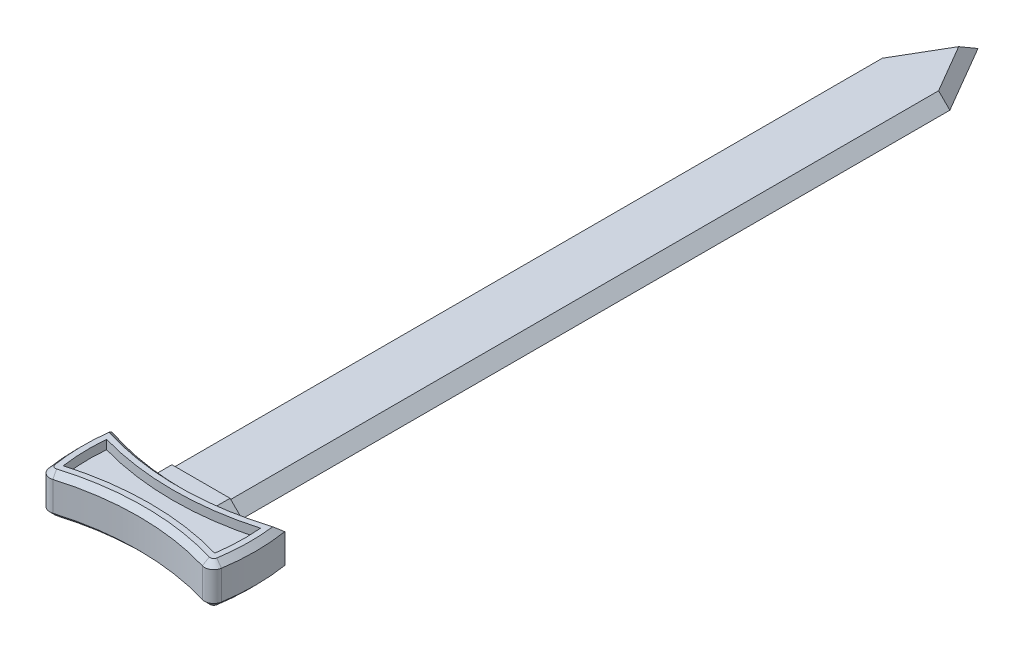
from build123d import *

# Parameters (mm, degrees)
EXTRUDE_1_DEPTH      = 18
CHAMFER_1_SIZE       = 5
CHAMFER_2_SIZE       = 5
CUT_EXTRUDE_1_DEPTH  = 8
EXTRUDE_2_REACH      = 696.741
EXTRUDE_2_END_RADIUS = 240


with BuildPart() as part:
    # 草图4 → 放样1 section 0
    with BuildSketch(Plane(origin=(0, 10, 0), x_dir=(1, 0, 0), z_dir=(0, 1, 0))):
        with BuildLine():
            Line((25, 0), (-25, 0))
            Line((-25, 0), (-25, 630))
            Line((-25, 630), (0, 672.857142857))
            Line((0, 672.857142857), (25, 630))
            Line((25, 630), (25, 0))
        make_face()
    # 草图1 → 放样1 section 1
    with BuildSketch(Plane(origin=(0, 0, 0), x_dir=(1, 0, 0), z_dir=(0, 1, 0))):
        with BuildLine():
            Line((-35, 0), (35, 0))
            Line((35, 0), (35, 630))
            Line((35, 630), (0, 690))
            Line((0, 690), (-35, 630))
            Line((-35, 630), (-35, 0))
        make_face()
    loft_1 = loft()

    # 镜向1: 放样1 across plane
    add(loft_1.mirror(Plane.ZX))



with BuildPart() as body_2:
    # 草图5 → 凸台-拉伸1 (new, symmetric)
    with BuildSketch(Plane(origin=(0, 0, 0), x_dir=(1, 0, 0), z_dir=(0, 1, 0))):
        with BuildLine():
            ThreePointArc((-66.346774613, -65.189169183), (0, -55.5), (66.346774613, -65.189169183))
            ThreePointArc((66.346774613, -65.189169183), (73.061224406, -64.270510235), (76.791165228, -58.612302768))
            ThreePointArc((76.791165228, -58.612302768), (79, -30.5), (76.791165228, -2.387697232))
            ThreePointArc((76.791165228, -2.387697232), (0, -15.004503167), (-76.791165228, -2.387697232))
            ThreePointArc((-76.791165228, -2.387697232), (-79, -30.5), (-76.791165228, -58.612302768))
            ThreePointArc((-76.791165228, -58.612302768), (-73.061224406, -64.270510235), (-66.346774613, -65.189169183))
        make_face()
    extrude(amount=EXTRUDE_1_DEPTH, both=True)

    # 倒角1
    chamfer_1_edges = [body_2.edges().sort_by_distance(p)[0] for p in [
        (0, 18, 15.004503167),
        (-79, 18, 30.5),
        (-73.061224406, 18, 64.270510235),
        (0, 18, 55.5),
        (73.061224406, 18, 64.270510235),
        (0, -18, 55.5),
        (-73.061224406, -18, 64.270510235),
        (-79, -18, 30.5),
        (79, -18, 30.5),
        (73.061224406, -18, 64.270510235),
        (79, 18, 30.5),
    ]]
    chamfer(chamfer_1_edges, length=CHAMFER_1_SIZE)

    # 倒角2
    chamfer_2_edges = [body_2.edges().sort_by_distance(p)[0] for p in [
        (0, -18, 15.004503167),
    ]]
    chamfer(chamfer_2_edges, length=CHAMFER_2_SIZE)

    # 草图6 → 切除-拉伸1 (cut)
    with BuildSketch(Plane(origin=(0, 18, 0), x_dir=(1, 0, 0), z_dir=(0, 1, 0))):
        with BuildLine():
            ThreePointArc((67.221840199, -55.023712607), (68.932610365, -35.286223394), (68.335500378, -15.483731767))
            ThreePointArc((68.335500378, -15.483731767), (0, -25.004503167), (-68.335500378, -15.483731767))
            ThreePointArc((-68.335500378, -15.483731767), (-68.932610365, -35.286223394), (-67.221840199, -55.023712607))
            ThreePointArc((-67.221840199, -55.023712607), (0, -45.5), (67.221840199, -55.023712607))
        make_face()
    cut_extrude_1 = extrude(amount=-CUT_EXTRUDE_1_DEPTH, mode=Mode.SUBTRACT)

    # 镜向2: 切除-拉伸1 across plane
    add(cut_extrude_1.mirror(Plane.ZX), mode=Mode.SUBTRACT)


with BuildPart() as part_1:
    add(part.part)

    add(body_2.part)  # 凸台-拉伸2 merges body 2
    # 凸台-拉伸2: up to this cylinder (the profile starts inside it)
    extrude_2_end = Plane(origin=(0, 0, -224.995496833), z_dir=(0, -1, 0)) * Cylinder(EXTRUDE_2_END_RADIUS, 1874.482, mode=Mode.PRIVATE)
    # 草图7 → 凸台-拉伸2 (add, up to the surface)
    with BuildSketch(Plane.XY, mode=Mode.PRIVATE) as extrude_2_sk1:
        Polygon((-25.828427125, 12), (-37.828427125, 0), (-25.828427125, -12), (25.828427125, -12), (37.828427125, 0), (25.828427125, 12), align=None)
    extrude_2_tool1 = extrude(extrude_2_sk1.sketch, amount=EXTRUDE_2_REACH, mode=Mode.PRIVATE) & extrude_2_end
    add(extrude_2_tool1.solids().sort_by_distance((0, 0, 0))[0])


solid = part_1.part
